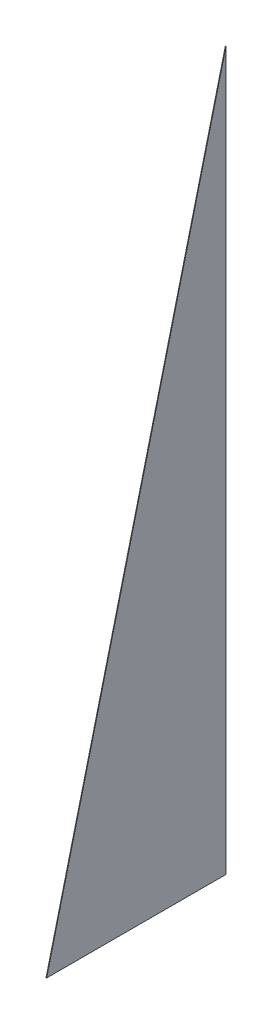
from build123d import *

# Parameters (mm, degrees)
BOSS_EXTRUDE1_DEPTH = 1


with BuildPart() as part:
    # Sketch1 → Boss-Extrude1 (new body)
    with BuildSketch(Plane(origin=(0, 0, 0), x_dir=(0, 0, -1), z_dir=(1, 0, 0))):
        Polygon((0, 0), (0, 1200), (-300, 0), align=None)
    extrude(amount=BOSS_EXTRUDE1_DEPTH)


solid = part.part
